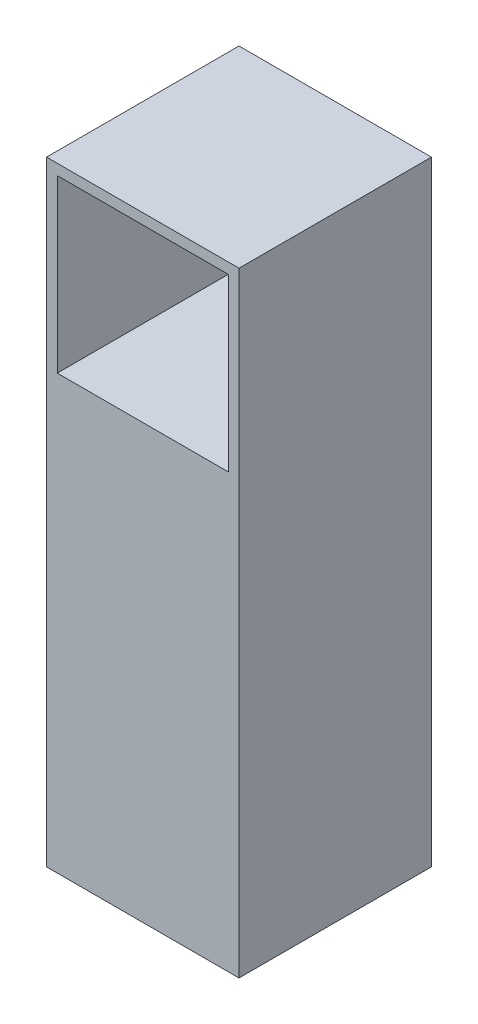
from build123d import *

# Parameters (mm, degrees)
SKETCH1_W           = 36
SKETCH1_H           = 36
BOSS_EXTRUDE1_DEPTH = 115
SKETCH2_W           = 32
SKETCH2_H           = 32
CUT_EXTRUDE1_DEPTH  = 115


with BuildPart() as part:
    # Sketch1 → Boss-Extrude1 (new body)
    with BuildSketch(Plane(origin=(0, 0, 0), x_dir=(1, 0, 0), z_dir=(0, 1, 0))):
        Rectangle(SKETCH1_W, SKETCH1_H)
    extrude(amount=BOSS_EXTRUDE1_DEPTH)

    # Sketch2 → Cut-Extrude1 (cut)
    with BuildSketch(Plane.XY.offset(18)):
        with Locations((0, 97)):
            Rectangle(SKETCH2_W, SKETCH2_H)
    extrude(amount=-CUT_EXTRUDE1_DEPTH, mode=Mode.SUBTRACT)


solid = part.part
